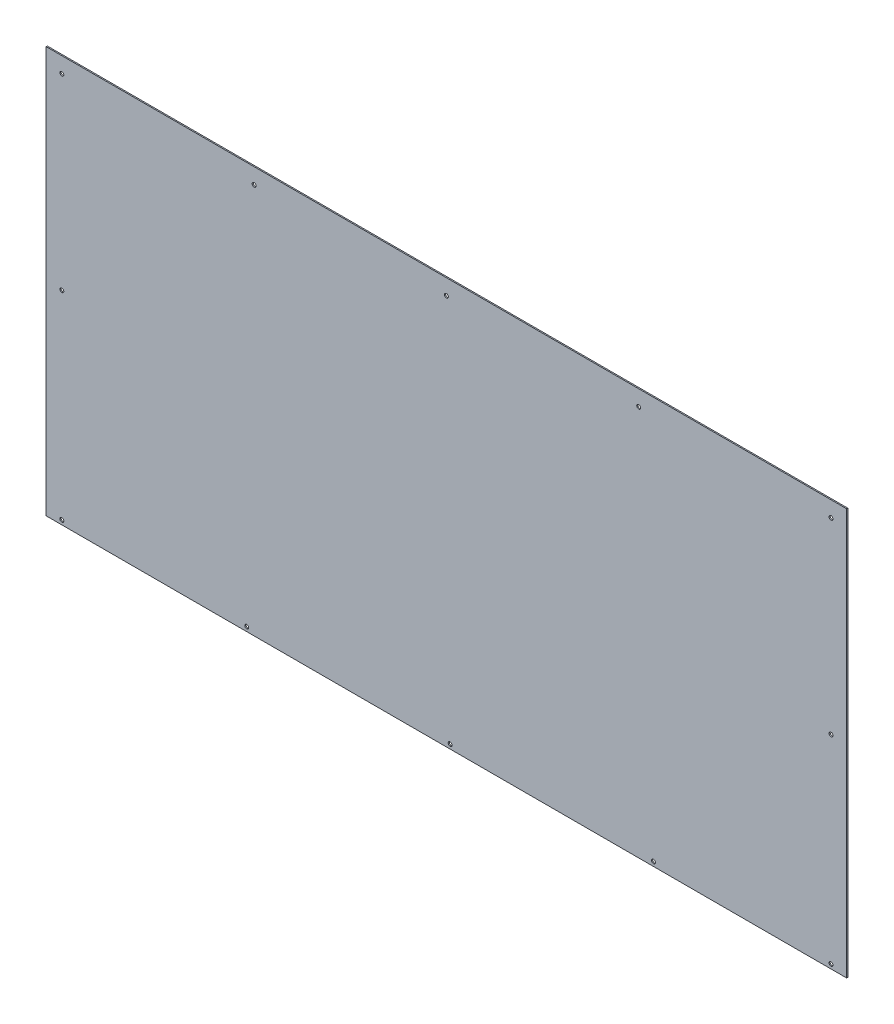
from build123d import *

# Parameters (mm, degrees)
CROQUIS1_W              = 1300
CROQUIS1_H              = 660
SALIENTE_EXTRUIR1_DEPTH = 1.9
CROQUIS2_R              = 3.175
CORTAR_EXTRUIR2_DEPTH   = 6.35
CROQUIS4_R              = 3.175
CORTAR_EXTRUIR3_DEPTH   = 10


with BuildPart() as part:
    # Croquis1 → Saliente-Extruir1 (new body)
    with BuildSketch(Plane.XY):
        Rectangle(CROQUIS1_W, CROQUIS1_H)
    extrude(amount=SALIENTE_EXTRUIR1_DEPTH)

    # Croquis2 → Cortar-Extruir2 (cut)
    with BuildSketch(Plane.XY.offset(1.9)):
        with Locations((-624.6, 304.6)):
            Circle(CROQUIS2_R)
        with Locations((0, 304.6)):
            Circle(CROQUIS2_R)
        with Locations((624.6, 304.6)):
            Circle(CROQUIS2_R)
        with Locations((-312.3, 304.6)):
            Circle(CROQUIS2_R)
        with Locations((312.3, 304.6)):
            Circle(CROQUIS2_R)
        with Locations((-624.6, 0)):
            Circle(CROQUIS2_R)
        with Locations((624.6, 0)):
            Circle(CROQUIS2_R)
        with Locations((-624.6, -323)):
            Circle(CROQUIS2_R)
        with Locations((624.6, -323)):
            Circle(CROQUIS2_R)
    extrude(amount=-CORTAR_EXTRUIR2_DEPTH, mode=Mode.SUBTRACT)

    # Croquis4 → Cortar-Extruir3 (cut)
    with BuildSketch(Plane(origin=(0, 0, 0), x_dir=(-1, 0, 0), z_dir=(0, 0, -1))):
        with Locations((324.3, -323)):
            Circle(CROQUIS4_R)
        with Locations((-6, -323)):
            Circle(CROQUIS4_R)
        with Locations((-336.3, -323)):
            Circle(CROQUIS4_R)
    extrude(amount=-CORTAR_EXTRUIR3_DEPTH, mode=Mode.SUBTRACT)


solid = part.part
